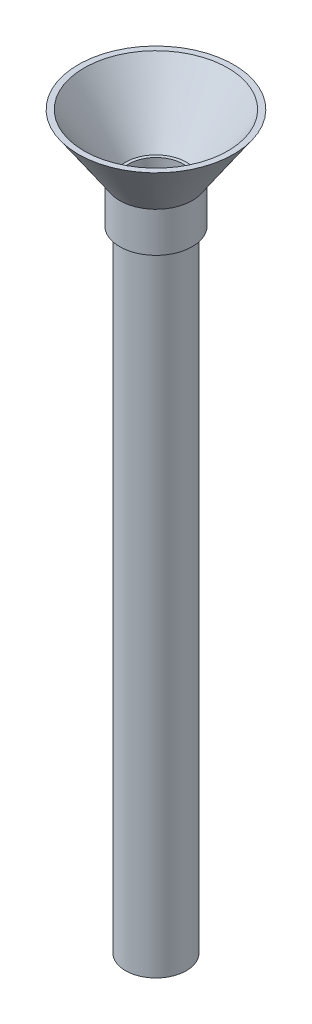
from build123d import *

# Parameters (mm, degrees)
SKETCH1_R           = 38.1
SKETCH1_R_2         = 34.121686747
BOSS_EXTRUDE1_DEPTH = 838.2


with BuildPart() as part:
    # Sketch1 → Boss-Extrude1 (new body)
    with BuildSketch(Plane(origin=(0, 0, 0), x_dir=(1, 0, 0), z_dir=(0, 1, 0))):
        with Locations(Location((0, 0, 0), (0, 0, 270))):
            Circle(SKETCH1_R)
        with Locations(Location((0, 0, 0), (0, 0, 270))):
            Circle(SKETCH1_R_2, mode=Mode.SUBTRACT)
    extrude(amount=BOSS_EXTRUDE1_DEPTH)

    # Sketch2 → Revolve1 (revolve)
    with BuildSketch(Plane(origin=(0, 0, 0), x_dir=(0, 0, -1), z_dir=(1, 0, 0))):
        Polygon((-38.1, 788.271478615), (-45.313643111, 788.271478615), (-45.313643111, 838.2), (-97.234227, 914.4), (-90.020583889, 914.4), (-38.1, 838.2), align=None)
    revolve(axis=Axis((0, 838.2, 0), (0, -1, 0)))


solid = part.part
